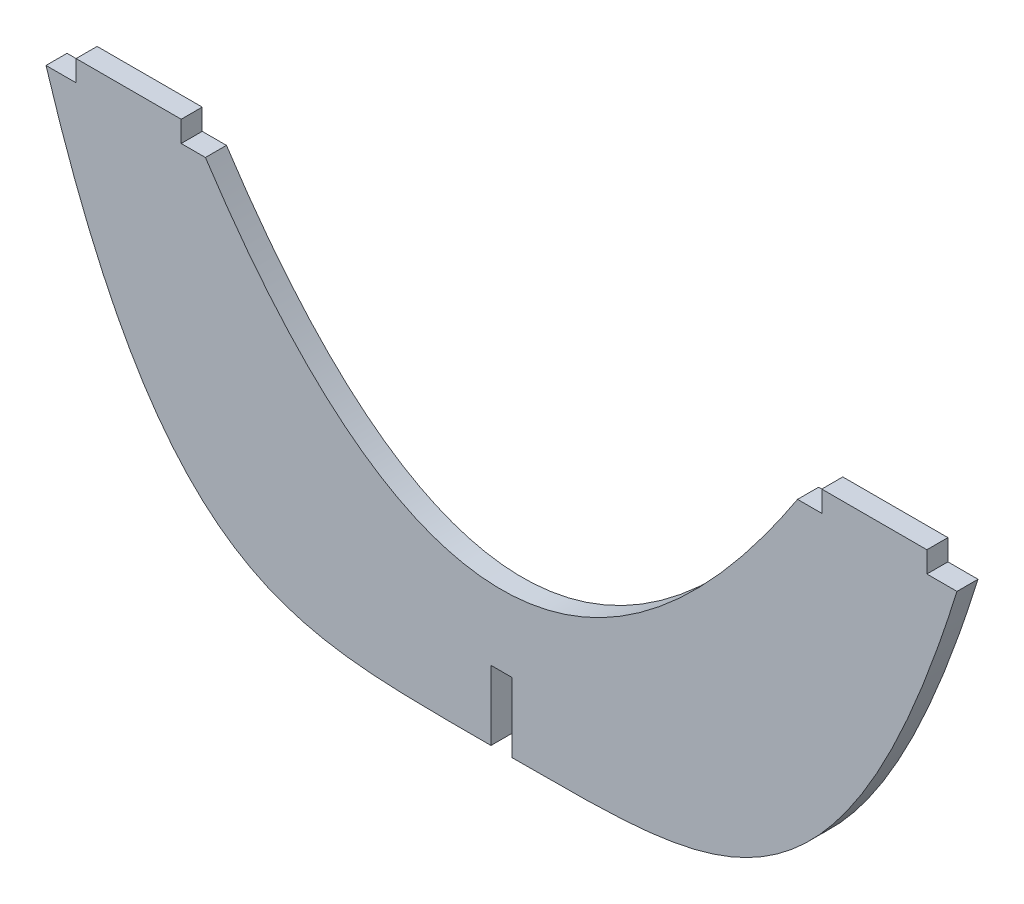
from build123d import *

# Parameters (mm, degrees)
EXTRUDE_1_DEPTH     = 3
CUT_EXTRUDE_4_DEPTH = 10
SKETCH_6_W          = 3
SKETCH_6_H          = 0.29
EXTRUDE_4_DEPTH     = 3


with BuildPart() as part:
    # 草图1 → 凸台-拉伸1 (new body)
    with BuildSketch(Plane.XY):
        with BuildLine():
            Line((-64.999999986, 52.296752884), (-60.705196958, 52.296752884))
            Line((-60.705196958, 52.296752884), (-60.705196958, 55.296750271))
            Line((-60.705196958, 55.296750271), (-45.705196958, 55.296750271))
            Line((-45.705196958, 55.296750271), (-45.705196958, 52.296752929))
            Line((-45.705196958, 52.296752929), (-42.249528739, 52.296752929))
            add(Edge.make_bspline(
                [(-42.249528739, 52.296752929), (0, -12.296752929), (42.249528739, 52.296752929)],
                knots=[0, 0, 0, 1, 1, 1], degree=2))
            Line((42.249528739, 52.296752929), (45.705196958, 52.296752929))
            Line((45.705196958, 52.296752929), (45.705196958, 55.296750271))
            Line((45.705196958, 55.296750271), (60.705196958, 55.296750271))
            Line((60.705196958, 55.296750271), (60.705196958, 52.296752884))
            Line((60.705196958, 52.296752884), (64.999999986, 52.296752884))
            add(Edge.make_bspline(
                [(-64.999999986, 52.296752884), (-32.499999991, -52.296752885), (0, 52.296752883), (32.499999995, -52.296752882), (64.999999986, 52.296752884)],
                knots=[0.035680117, 0.035680117, 0.035680117, 0.035680117, 0.035680117, 0.964319883, 0.964319883, 0.964319883, 0.964319883, 0.964319883], degree=4))
        make_face()
    extrude(amount=EXTRUDE_1_DEPTH)

    # 草图4 → 切除-拉伸4 (cut)
    with BuildSketch(Plane.XY.offset(3)):
        Polygon((-1.5, 1.4832e-05), (-1.5, -2.686062371), (1.5, -2.686062371), (1.5, 0.000504044), (1.5, 10.2), (-1.5, 10.2), align=None)
    extrude(amount=-CUT_EXTRUDE_4_DEPTH, mode=Mode.SUBTRACT)

    # 草图6 → 凸台-拉伸4 (add)
    with BuildSketch(Plane(origin=(0, 0, 0), x_dir=(-1, 0, 0), z_dir=(0, 0, -1))):
        with Locations((0, 10.055)):
            Rectangle(SKETCH_6_W, SKETCH_6_H)
    extrude(amount=-EXTRUDE_4_DEPTH)


solid = part.part
